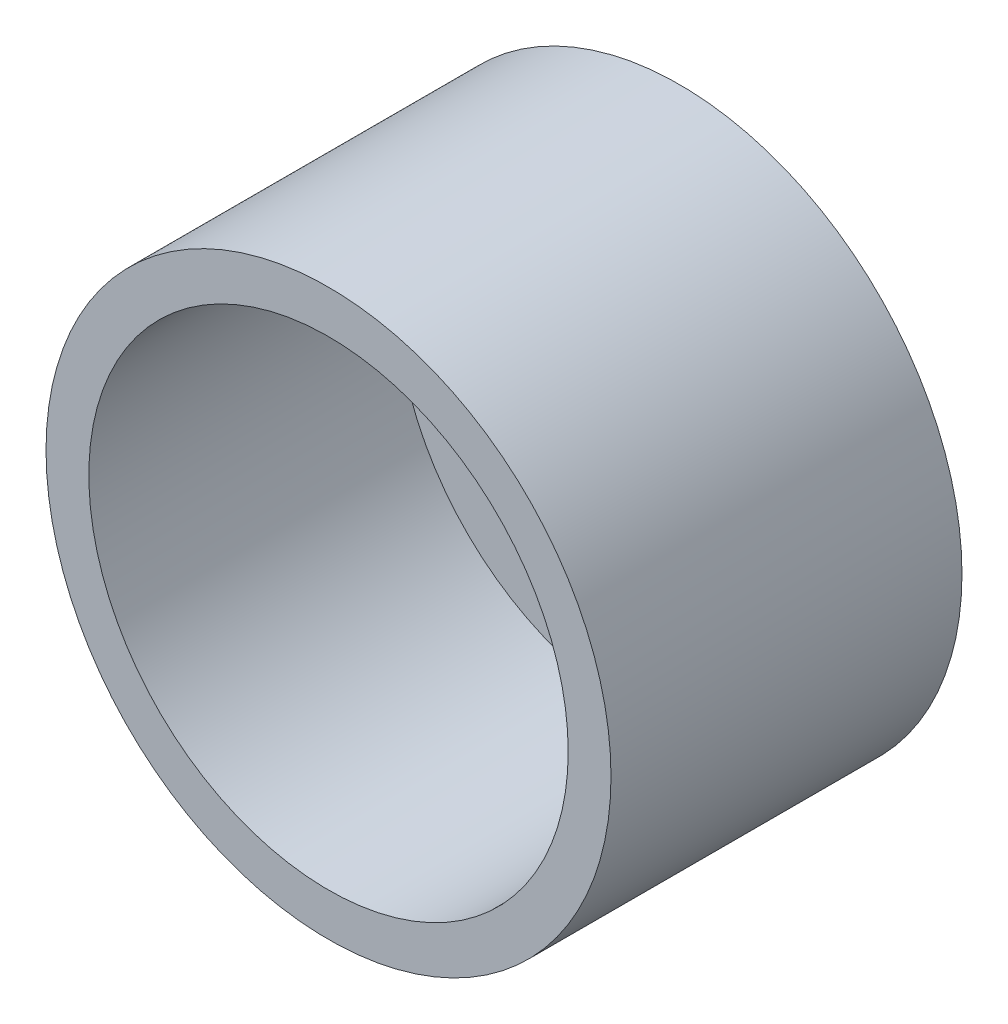
from build123d import *

# Parameters (mm, degrees)
SKETCH1_R           = 14
BOSS_EXTRUDE1_DEPTH = 18
SHELL1_T            = 2.5


with BuildPart() as part:
    # Sketch1 → Boss-Extrude1 (new body)
    with BuildSketch(Plane.XY):
        Circle(SKETCH1_R)
    extrude(amount=BOSS_EXTRUDE1_DEPTH)

    # Shell1
    shell1_openings = [part.faces().sort_by_distance(p)[0] for p in [
        (0, 0, 18),
    ]]
    offset(amount=SHELL1_T, openings=shell1_openings, kind=Kind.INTERSECTION)


solid = part.part
